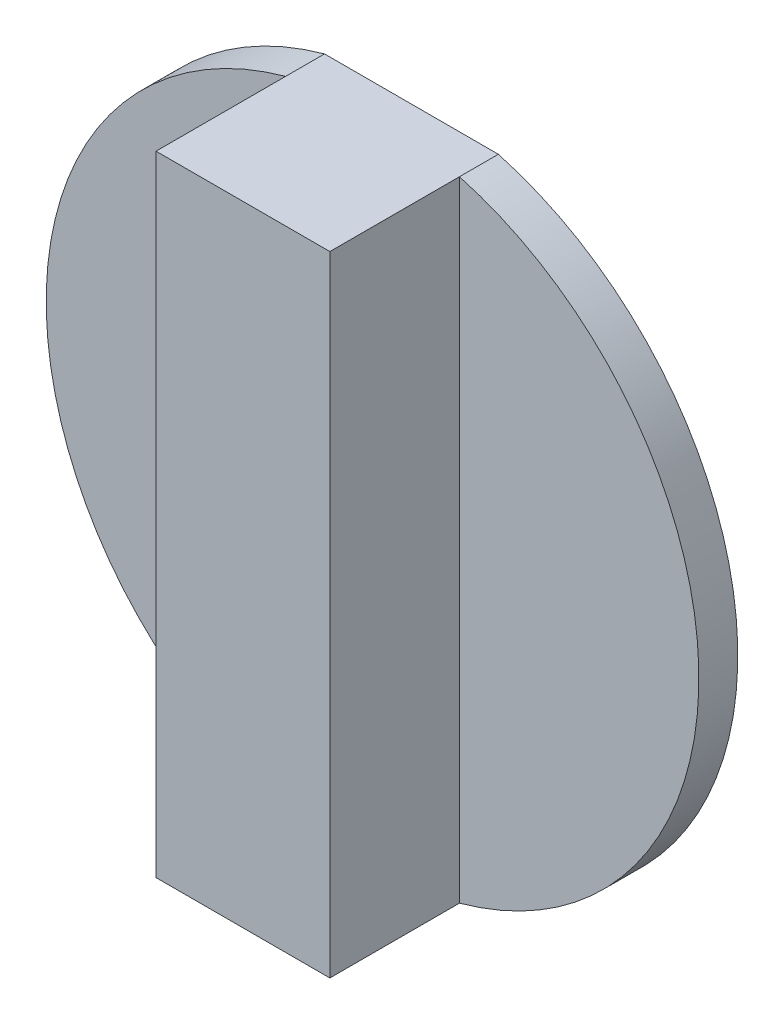
from build123d import *

# Parameters (mm, degrees)
BOSS_EXTRUDE4_DEPTH = 3
SKETCH2_W           = 13.411682353
SKETCH2_H           = 48.538644398
BOSS_EXTRUDE5_DEPTH = 10


with BuildPart() as part:
    # Sketch1 → Boss-Extrude4 (new body)
    with BuildSketch(Plane.XY):
        with BuildLine():
            Line((10.190210498, 139.492737182), (-3.221471855, 139.492737182))
            ThreePointArc((-3.221471855, 139.492737182), (-21.694357927, 115.223414983), (-3.221471855, 90.954092784))
            Line((-3.221471855, 90.954092784), (10.190210498, 90.954092784))
            ThreePointArc((10.190210498, 90.954092784), (28.663096571, 115.223414983), (10.190210498, 139.492737182))
        make_face()
    extrude(amount=BOSS_EXTRUDE4_DEPTH)

    # Sketch2 → Boss-Extrude5 (add)
    with BuildSketch(Plane.XY.offset(3)):
        with Locations((3.484369322, 115.223414983)):
            Rectangle(SKETCH2_W, SKETCH2_H)
    extrude(amount=BOSS_EXTRUDE5_DEPTH)


solid = part.part
